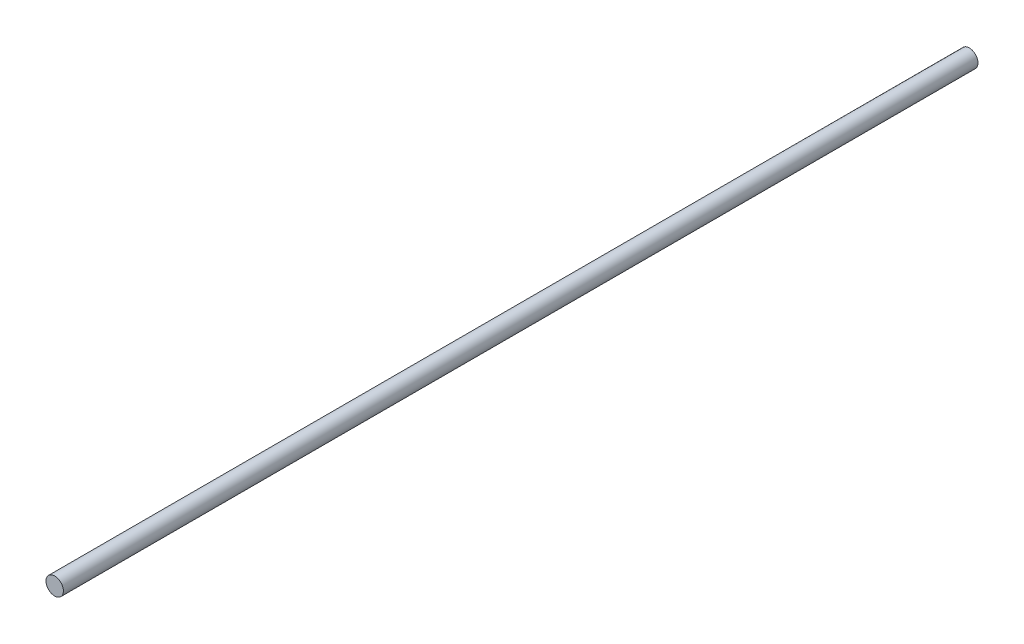
from build123d import *

# Parameters (mm, degrees)
SKETCH_1_R      = 4.7625
EXTRUDE_1_DEPTH = 500


with BuildPart() as part:
    # 草图1 → 凸台-拉伸1 (new body)
    with BuildSketch(Plane.XY):
        Circle(SKETCH_1_R)
    extrude(amount=EXTRUDE_1_DEPTH)


solid = part.part
